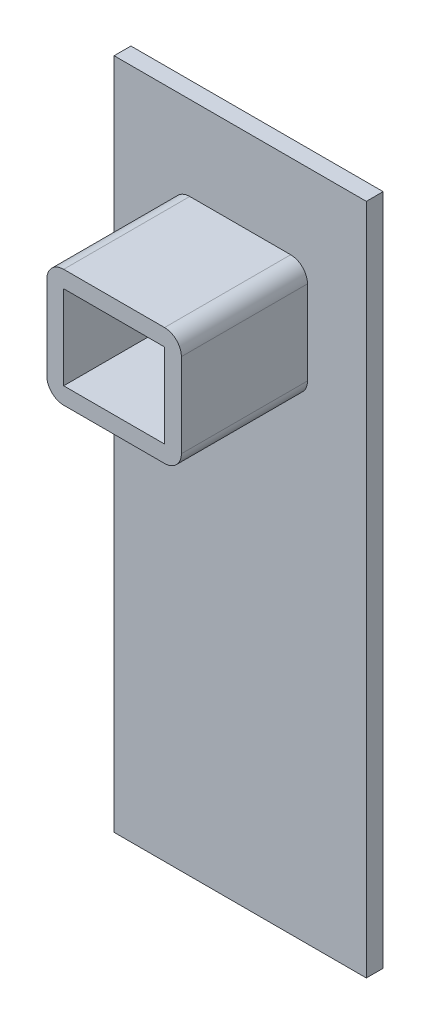
from build123d import *

# Parameters (mm, degrees)
SKETCH_1_W      = 30
SKETCH_1_H      = 80
EXTRUDE_1_DEPTH = 2
SKETCH_2_W      = 16
SKETCH_2_H      = 14
SKETCH_2_W_2    = 12
SKETCH_2_H_2    = 10
EXTRUDE_2_DEPTH = 15
FILLET_1_R      = 2


with BuildPart() as part:
    # 草图1 → 凸台-拉伸1 (new body)
    with BuildSketch(Plane.XY):
        with Locations((15, -40)):
            Rectangle(SKETCH_1_W, SKETCH_1_H)
    extrude(amount=EXTRUDE_1_DEPTH)

    # 草图2 → 凸台-拉伸2 (add)
    with BuildSketch(Plane.XY.offset(2)):
        with Locations((15, -17)):
            Rectangle(SKETCH_2_W, SKETCH_2_H)
        with Locations((15, -17)):
            Rectangle(SKETCH_2_W_2, SKETCH_2_H_2, mode=Mode.SUBTRACT)
    extrude(amount=EXTRUDE_2_DEPTH)

    # 圆角1
    fillet_1_edges = [part.edges().sort_by_distance(p)[0] for p in [
        (23, -10, 9.5),
        (7, -10, 9.5),
        (7, -24, 9.5),
        (23, -24, 9.5),
    ]]
    fillet(fillet_1_edges, radius=FILLET_1_R)


solid = part.part
